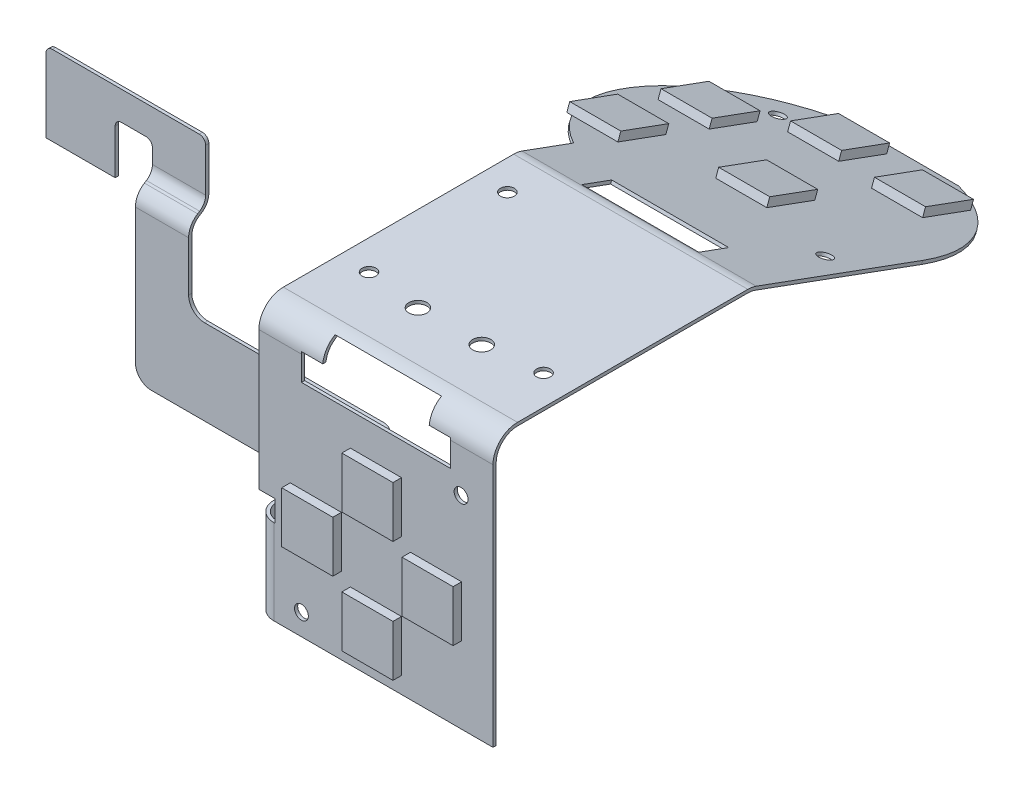
from build123d import *

# Parameters (mm, degrees)
EXTRUDE_1_DEPTH     = 22
CUT_EXTRUDE_1_DEPTH = 4
CUT_EXTRUDE_2_DEPTH = 64.319089808
SKETCH_3_3_R        = 14
EXTRUDE_2_DEPTH     = 0.3
SKETCH_4_W          = 4.8
SKETCH_4_H          = 4.8
EXTRUDE_3_DEPTH     = 0.8
SKETCH_5_R          = 0.85
CUT_EXTRUDE_3_DEPTH = 63.897702188
SKETCH_6_W          = 11
SKETCH_6_H          = 3
CUT_EXTRUDE_4_DEPTH = 1
SKETCH_7_W          = 4.8
SKETCH_7_H          = 4.8
EXTRUDE_4_DEPTH     = 0.8
SKETCH_9_W          = 1.5
SKETCH_9_H          = 0.3
CUT_EXTRUDE_5_DEPTH = 10
EXTRUDE_5_DEPTH     = 8
EXTRUDE_6_DEPTH     = 0.3
EXTRUDE_7_DEPTH     = 5
EXTRUDE_8_DEPTH     = 0.3
SKETCH_14_R         = 0.65
SKETCH_14_W         = 12
SKETCH_14_H         = 2
CUT_EXTRUDE_6_DEPTH = 4
SKETCH_15_R         = 0.65
CUT_EXTRUDE_7_DEPTH = 4
SKETCH_16_R         = 0.65
CUT_EXTRUDE_8_DEPTH = 4


with BuildPart() as part:
    # 草图1 → 凸台-拉伸1 (new body)
    with BuildSketch(Plane(origin=(0, 0, 0), x_dir=(0, 0, -1), z_dir=(1, 0, 0))):
        with BuildLine():
            Line((0, -25), (0, -2))
            ThreePointArc((0, -2), (0.585786438, -0.585786438), (2, 0))
            Line((2, 0), (23.64572618, 0))
            ThreePointArc((23.64572618, 0), (23.99456936, -0.030657867), (24.332717753, -0.121691565))
            Line((24.332717753, -0.121691565), (52.174626532, -10.304873595))
            Line((52.174626532, -10.304873595), (52.277675268, -10.023127329))
            Line((52.277675268, -10.023127329), (24.435766489, 0.160054701))
            ThreePointArc((24.435766489, 0.160054701), (24.046895837, 0.264743453), (23.64572618, 0.3))
            Line((23.64572618, 0.3), (2, 0.3))
            ThreePointArc((2, 0.3), (0.373654403, -0.373654403), (-0.3, -2))
            Line((-0.3, -2), (-0.3, -25))
            Line((-0.3, -25), (0, -25))
        make_face()
    extrude(amount=EXTRUDE_1_DEPTH)

    # 草图2 → 切除-拉伸1 (cut)
    with BuildSketch(Plane.XY.offset(0.3)):
        Polygon((4, -4.3), (18, -4.3), (18, -1.8), (16, -1.8), (16, 0), (6, 0), (6, -1.8), (4, -1.8), align=None)
    extrude(amount=-CUT_EXTRUDE_1_DEPTH, mode=Mode.SUBTRACT)

    # 草图3 → 切除-拉伸2 (cut, through all)
    with BuildSketch(Plane(origin=(0, 8.024038665, -2.934793264), x_dir=(1, 0, 0), z_dir=(0, 0.9391542177229502, -0.3434957864853564))):
        with BuildLine():
            ThreePointArc((13.196152423, 52.539701225), (19.591939741, 47.38998358), (22, 39.539701225))
            Line((22, 39.539701225), (22, 52.539701225))
            Line((22, 52.539701225), (13.196152423, 52.539701225))
        make_face()
        with BuildLine():
            ThreePointArc((0, 51.028826518), (1.358818231, 51.864258204), (2.803847577, 52.539701225))
            Line((2.803847577, 52.539701225), (0, 52.539701225))
            Line((0, 52.539701225), (0, 51.028826518))
        make_face()
    extrude(amount=-CUT_EXTRUDE_2_DEPTH, mode=Mode.SUBTRACT)

    # 草图3<3> → 凸台-拉伸2 (add)
    with BuildSketch(Plane(origin=(0, 8.024038665, -2.934793264), x_dir=(1, 0, 0), z_dir=(0, 0.9391542177229502, -0.3434957864853564))):
        with Locations((8, 39.539701225)):
            Circle(SKETCH_3_3_R)
    extrude(amount=-EXTRUDE_2_DEPTH)

    # 草图4 → 凸台-拉伸3 (add)
    with BuildSketch(Plane.XY.offset(0.3)):
        with Locations((11, -9.75)):
            Rectangle(SKETCH_4_W, SKETCH_4_H)
        with Locations((11, -21.05)):
            Rectangle(SKETCH_4_W, SKETCH_4_H)
        with Locations((5.35, -15.4)):
            Rectangle(SKETCH_4_W, SKETCH_4_H)
        with Locations((16.65, -15.4)):
            Rectangle(SKETCH_4_W, SKETCH_4_H)
    extrude(amount=EXTRUDE_3_DEPTH)

    # 草图5 → 切除-拉伸3 (cut, through all)
    with BuildSketch(Plane(origin=(0, 0.3, 0), x_dir=(1, 0, 0), z_dir=(0, 1, 0))):
        with Locations((8, 6.64572618)):
            Circle(SKETCH_5_R)
        with Locations((14, 6.64572618)):
            Circle(SKETCH_5_R)
    extrude(amount=-CUT_EXTRUDE_3_DEPTH, mode=Mode.SUBTRACT)

    # 草图6 → 切除-拉伸4 (cut)
    with BuildSketch(Plane(origin=(0, 8.024038665, -2.934793264), x_dir=(1, 0, 0), z_dir=(0, 0.9391542177229502, -0.3434957864853564))):
        with Locations((11, 24.5)):
            Rectangle(SKETCH_6_W, SKETCH_6_H)
    extrude(amount=-CUT_EXTRUDE_4_DEPTH, mode=Mode.SUBTRACT)

    # 草图7 → 凸台-拉伸4 (add)
    with BuildSketch(Plane(origin=(0, 8.024038665, -2.934793264), x_dir=(1, 0, 0), z_dir=(0, 0.9391542177229502, -0.3434957864853564))):
        with Locations((9.738477049, 36.851443585)):
            Rectangle(SKETCH_7_W, SKETCH_7_H)
        with Locations((14.118767038, 47.774445204)):
            Rectangle(SKETCH_7_W, SKETCH_7_H)
        with Locations((5.219570287, 48.855656024)):
            Rectangle(SKETCH_7_W, SKETCH_7_H)
        with Locations((-1.489481468, 43.037611303)):
            Rectangle(SKETCH_7_W, SKETCH_7_H)
        with Locations((-1.651961899, 34.079108149)):
            Rectangle(SKETCH_7_W, SKETCH_7_H)
    extrude(amount=EXTRUDE_4_DEPTH)

    # 草图9 → 切除-拉伸5 (cut)
    with BuildSketch(Plane.XZ.offset(25)):
        with Locations((0.75, 0.15)):
            Rectangle(SKETCH_9_W, SKETCH_9_H)
    extrude(amount=-CUT_EXTRUDE_5_DEPTH, mode=Mode.SUBTRACT)

    # 草图10 → 凸台-拉伸5 (add)
    with BuildSketch(Plane.XZ.offset(25)):
        with BuildLine():
            Line((1.5, 0), (1.4, 0))
            ThreePointArc((1.4, 0), (0.339339828, -0.439339828), (-0.1, -1.5))
            Line((-0.1, -1.5), (-0.1, -11.5))
            ThreePointArc((-0.1, -11.5), (-0.539339828, -12.560660172), (-1.6, -13))
            Line((-1.6, -13), (-17.6, -13))
            Line((-17.6, -13), (-17.6, -12.7))
            Line((-17.6, -12.7), (-1.6, -12.7))
            ThreePointArc((-1.6, -12.7), (-0.751471863, -12.348528137), (-0.4, -11.5))
            Line((-0.4, -11.5), (-0.4, -1.5))
            ThreePointArc((-0.4, -1.5), (0.127207794, -0.227207794), (1.4, 0.3))
            Line((1.4, 0.3), (1.5, 0.3))
            Line((1.5, 0.3), (1.5, 0))
        make_face()
    extrude(amount=-EXTRUDE_5_DEPTH)

    # 草图11 → 凸台-拉伸6 (add)
    with BuildSketch(Plane.XY.offset(-12.7)):
        with BuildLine():
            Line((-17.6, -17), (-17.6, -25))
            Line((-17.6, -25), (-23.1, -25))
            ThreePointArc((-23.1, -25), (-24.160660172, -24.560660172), (-24.6, -23.5))
            Line((-24.6, -23.5), (-24.6, -11))
            Line((-24.6, -11), (-19.6, -11))
            Line((-19.6, -11), (-19.6, -15.5))
            ThreePointArc((-19.6, -15.5), (-19.160660172, -16.560660172), (-18.1, -17))
            Line((-18.1, -17), (-17.6, -17))
        make_face()
    extrude(amount=-EXTRUDE_6_DEPTH)

    # 草图12 → 凸台-拉伸7 (add)
    with BuildSketch(Plane.ZY.offset(24.6)):
        with BuildLine():
            Line((-13, -11), (-13, -10.831371462))
            ThreePointArc((-13, -10.831371462), (-13.188036278, -10.104218664), (-13.70500159, -9.559374006))
            Line((-13.70500159, -9.559374006), (-13.89499841, -9.440625994))
            ThreePointArc((-13.89499841, -9.440625994), (-14.411963722, -8.895781336), (-14.6, -8.168628538))
            Line((-14.6, -8.168628538), (-14.6, -8))
            Line((-14.6, -8), (-14.3, -8))
            Line((-14.3, -8), (-14.3, -8.168628538))
            ThreePointArc((-14.3, -8.168628538), (-14.149570977, -8.750350777), (-13.735998728, -9.186226503))
            Line((-13.735998728, -9.186226503), (-13.546001908, -9.304974515))
            ThreePointArc((-13.546001908, -9.304974515), (-12.925643534, -9.958788104), (-12.7, -10.831371462))
            Line((-12.7, -10.831371462), (-12.7, -11))
            Line((-12.7, -11), (-13, -11))
        make_face()
    extrude(amount=-EXTRUDE_7_DEPTH)

    # 草图13 → 凸台-拉伸8 (add)
    with BuildSketch(Plane.XY.offset(-14.3)):
        with BuildLine():
            Line((-24.6, -8), (-19.6, -8))
            Line((-19.6, -8), (-19.6, -4.1))
            ThreePointArc((-19.6, -4.1), (-19.775735931, -3.675735931), (-20.2, -3.5))
            Line((-20.2, -3.5), (-34, -3.5))
            ThreePointArc((-34, -3.5), (-34.424264069, -3.675735931), (-34.6, -4.1))
            Line((-34.6, -4.1), (-34.6, -11))
            Line((-34.6, -11), (-28.1, -11))
            Line((-28.1, -11), (-28.1, -6.8))
            ThreePointArc((-28.1, -6.8), (-27.924264069, -6.375735931), (-27.5, -6.2))
            Line((-27.5, -6.2), (-25.2, -6.2))
            ThreePointArc((-25.2, -6.2), (-24.775735931, -6.375735931), (-24.6, -6.8))
            Line((-24.6, -6.8), (-24.6, -8))
        make_face()
    extrude(amount=-EXTRUDE_8_DEPTH)

    # 草图14 → 切除-拉伸6 (cut)
    with BuildSketch(Plane(origin=(0, 8.024038665, -2.934793264), x_dir=(1, 0, 0), z_dir=(0, 0.9391542177229502, -0.3434957864853564))):
        with Locations((0.5, 47.950575932)):
            Circle(SKETCH_14_R)
        with Locations((19.5, 32.450575932)):
            Circle(SKETCH_14_R)
        with Locations((8, 53.550575932)):
            Rectangle(SKETCH_14_W, SKETCH_14_H)
    extrude(amount=-CUT_EXTRUDE_6_DEPTH, mode=Mode.SUBTRACT)

    # 草图15 → 切除-拉伸7 (cut)
    with BuildSketch(Plane(origin=(0, 0.3, 0), x_dir=(1, 0, 0), z_dir=(0, 1, 0))):
        with Locations((2.8, 20.25)):
            Circle(SKETCH_15_R)
        with Locations((2.8, 7.25)):
            Circle(SKETCH_15_R)
        with Locations((19.2, 7.25)):
            Circle(SKETCH_15_R)
    extrude(amount=-CUT_EXTRUDE_7_DEPTH, mode=Mode.SUBTRACT)

    # 草图16 → 切除-拉伸8 (cut)
    with BuildSketch(Plane.XY.offset(0.3)):
        with Locations((19, -6)):
            Circle(SKETCH_16_R)
        with Locations((4, -23)):
            Circle(SKETCH_16_R)
    extrude(amount=-CUT_EXTRUDE_8_DEPTH, mode=Mode.SUBTRACT)


solid = part.part
